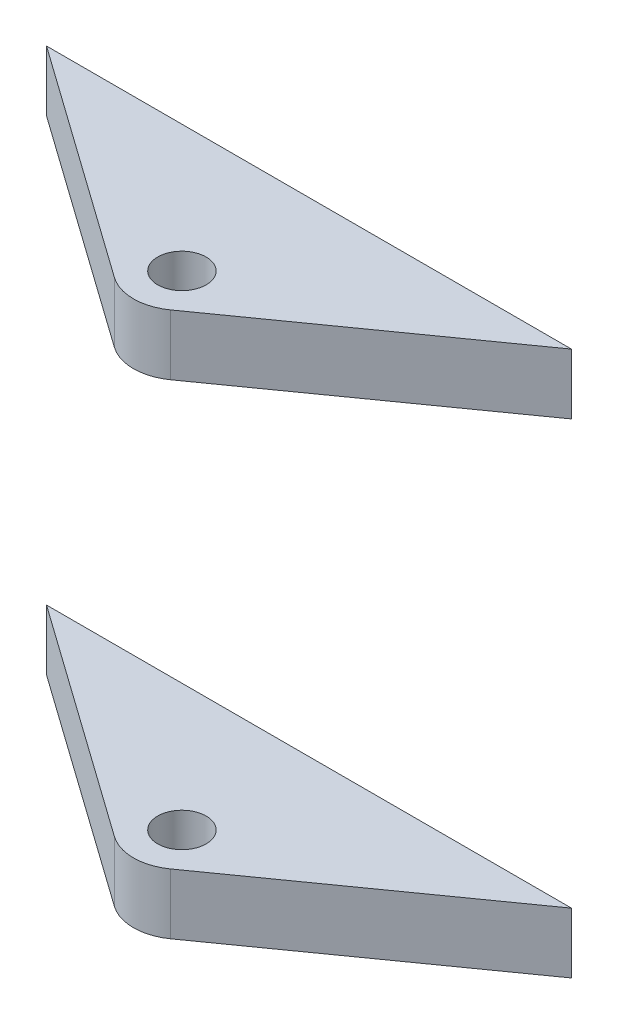
from build123d import *

# Parameters (mm, degrees)
SKETCH2_W               = 86.746757864
SKETCH2_H               = 10
BOSS_EXTRUDE1_DEPTH     = 50
BOSS_EXTRUDE1_2_DEPTH   = 50
CUT_EXTRUDE1_DEPTH      = 115.685870942
CUT_EXTRUDE1_DEPTH_BACK = 115.685870942
SKETCH3_R               = 4


with BuildPart() as part:
    # Sketch2 → Boss-Extrude1 (new body)
    with BuildSketch(Plane.XY):
        with Locations((7.152347127, 34.722322634)):
            Rectangle(SKETCH2_W, SKETCH2_H)
    extrude(amount=BOSS_EXTRUDE1_DEPTH)


with BuildPart() as body_2:
    # Sketch2 → Boss-Extrude1 2 (new body)
    with BuildSketch(Plane.XY):
        with Locations((7.152347127, -45.277677366)):
            Rectangle(SKETCH2_W, SKETCH2_H)
    extrude(amount=BOSS_EXTRUDE1_2_DEPTH)


with BuildPart() as cut_extrude1_tool:
    # Sketch3 → Cut-Extrude1 (new, two sides: drawn at the far end of the back side and taken through both)
    with BuildSketch(Plane(origin=(0, 39.722322634, 0), x_dir=(1, 0, 0), z_dir=(0, 1, 0)).offset(-CUT_EXTRUDE1_DEPTH_BACK)):
        with BuildLine():
            Line((50.525726059, -50), (50.525726059, 0))
            Line((50.525726059, 0), (11.78554007, -27.521773007))
            ThreePointArc((11.78554007, -27.521773007), (7.152347127, -29), (2.519154185, -27.521773007))
            Line((2.519154185, -27.521773007), (-36.221031805, 0))
            Line((-36.221031805, 0), (-36.221031805, -50))
            Line((-36.221031805, -50), (50.525726059, -50))
        make_face()
        with Locations(Location((7.152347127, -21, 0), (0, 0, 270))):
            Circle(SKETCH3_R)
    extrude(amount=CUT_EXTRUDE1_DEPTH + CUT_EXTRUDE1_DEPTH_BACK)


with BuildPart() as part_1:
    add(part.part)

    # Cut-Extrude1: cut by cut_extrude1_tool
    add(cut_extrude1_tool.part, mode=Mode.SUBTRACT)


with BuildPart() as body_2_1:
    add(body_2.part)

    # Cut-Extrude1: cut by cut_extrude1_tool
    add(cut_extrude1_tool.part, mode=Mode.SUBTRACT)


solid = Compound([part_1.part, body_2_1.part])
